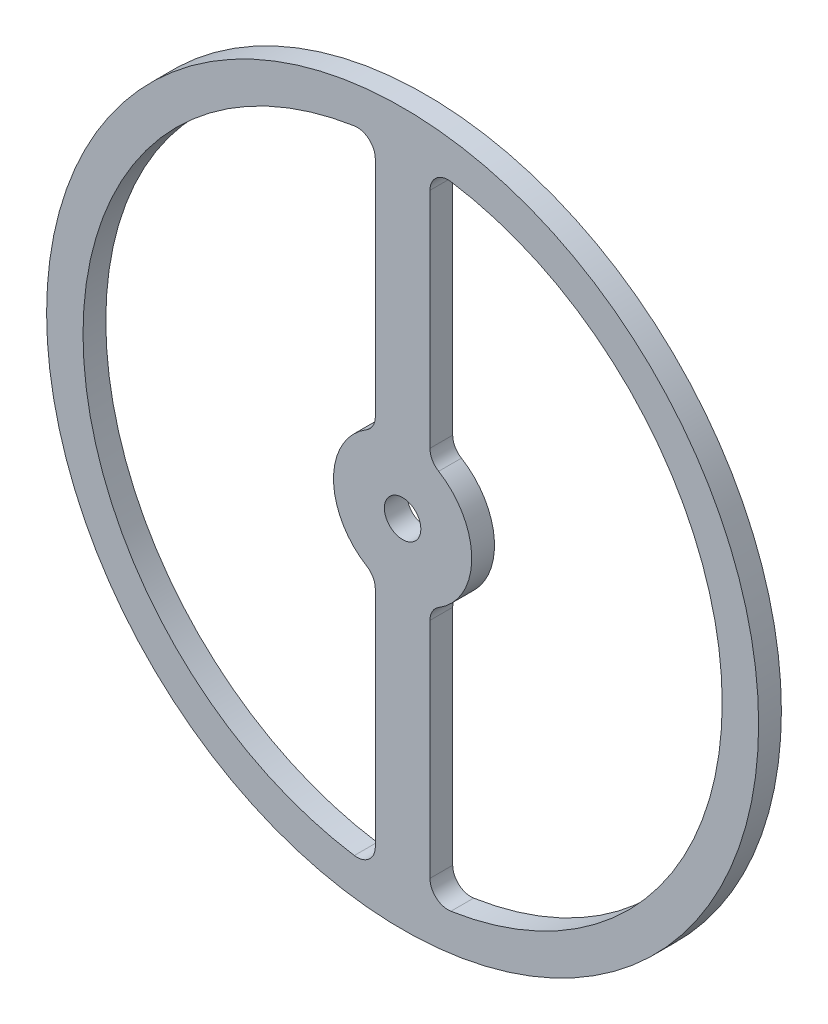
from build123d import *

# Parameters (mm, degrees)
SKETCH1_R           = 49.657
BOSS_EXTRUDE1_DEPTH = 3.175
CUT_EXTRUDE1_DEPTH  = 71.297339374
FILLET1_R           = 2.54
FILLET2_R           = 2.54
SKETCH4_R           = 2.54
CUT_EXTRUDE2_DEPTH  = 71.297339374


with BuildPart() as part:
    # Sketch1 → Boss-Extrude1 (new body)
    with BuildSketch(Plane.XY):
        Circle(SKETCH1_R)
    extrude(amount=BOSS_EXTRUDE1_DEPTH)

    # Sketch3 → Cut-Extrude1 (cut, through all)
    with BuildSketch(Plane.XY.offset(3.175)):
        with BuildLine():
            Line((-3.81, 44.41388104), (-3.81, 8.85388104))
            ThreePointArc((-3.81, 8.85388104), (-9.638843783, 0), (-3.81, -8.85388104))
            Line((-3.81, -8.85388104), (-3.81, -44.41388104))
            ThreePointArc((-3.81, -44.41388104), (-44.577, 0), (-3.81, 44.41388104))
        make_face()
        with BuildLine():
            Line((3.81, 8.85388104), (3.81, 44.41388104))
            ThreePointArc((3.81, 44.41388104), (44.577, 0), (3.81, -44.41388104))
            Line((3.81, -44.41388104), (3.81, -8.85388104))
            ThreePointArc((3.81, -8.85388104), (9.638843783, 0), (3.81, 8.85388104))
        make_face()
    extrude(amount=-CUT_EXTRUDE1_DEPTH, mode=Mode.SUBTRACT)

    # Fillet1
    fillet1_edges = [part.edges().sort_by_distance(p)[0] for p in [
        (-3.81, -44.41388104, 1.5875),
        (-3.81, 44.41388104, 1.5875),
        (3.81, -44.41388104, 1.5875),
        (3.81, 44.41388104, 1.5875),
    ]]
    fillet(fillet1_edges, radius=FILLET1_R)

    # Fillet2
    fillet2_edges = [part.edges().sort_by_distance(p)[0] for p in [
        (-3.81, -8.85388104, 1.5875),
        (-3.81, 8.85388104, 1.5875),
        (3.81, 8.85388104, 1.5875),
        (3.81, -8.85388104, 1.5875),
    ]]
    fillet(fillet2_edges, radius=FILLET2_R)

    # Sketch4 → Cut-Extrude2 (cut, through all)
    with BuildSketch(Plane.XY.offset(3.175)):
        Circle(SKETCH4_R)
    extrude(amount=-CUT_EXTRUDE2_DEPTH, mode=Mode.SUBTRACT)


solid = part.part
